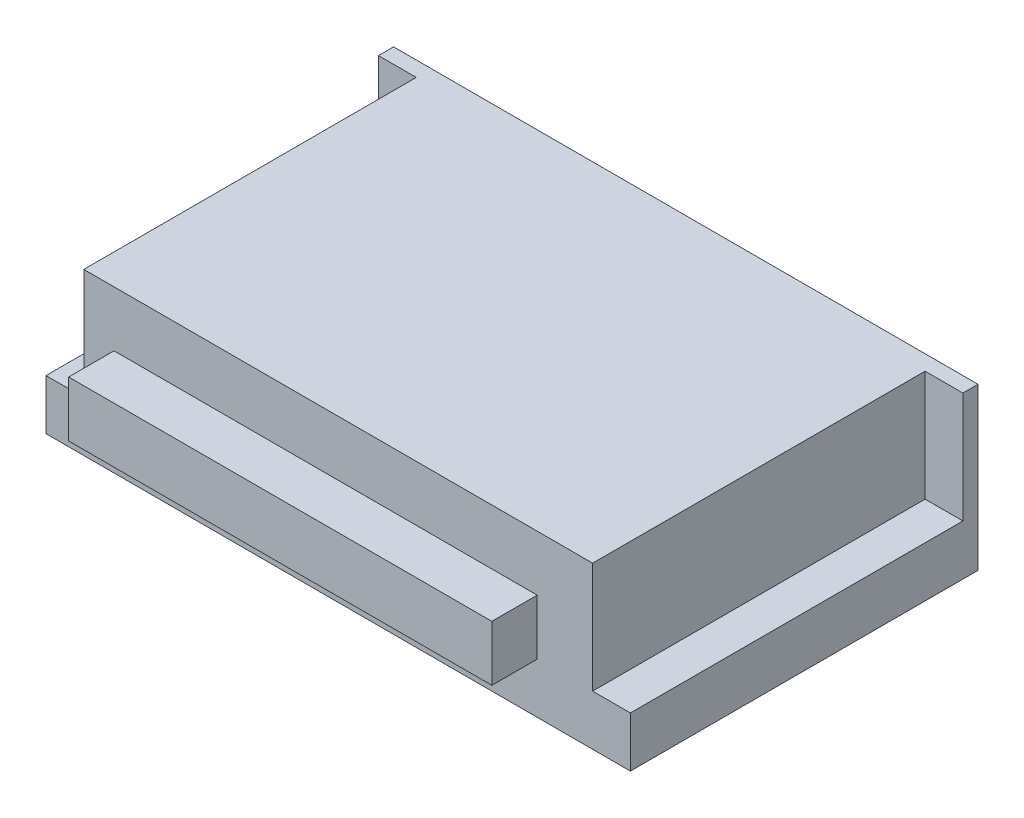
from build123d import *

# Parameters (mm, degrees)
SKETCH_1_W          = 116
SKETCH_1_H          = 69
EXTRUDE_1_DEPTH     = 32
SKETCH_2_W          = 7.5
SKETCH_2_H          = 66
CUT_EXTRUDE_1_DEPTH = 22
SKETCH_3_W          = 84
SKETCH_3_H          = 11
EXTRUDE_2_DEPTH     = 9


with BuildPart() as part:
    # 草图1 → 凸台-拉伸1 (new body)
    with BuildSketch(Plane(origin=(0, 0, 0), x_dir=(1, 0, 0), z_dir=(0, 1, 0))):
        with Locations((58, 34.5)):
            Rectangle(SKETCH_1_W, SKETCH_1_H)
    extrude(amount=EXTRUDE_1_DEPTH)

    # 草图2 → 切除-拉伸1 (cut)
    with BuildSketch(Plane(origin=(0, 32, 0), x_dir=(1, 0, 0), z_dir=(0, 1, 0))):
        with Locations((112.25, 33)):
            Rectangle(SKETCH_2_W, SKETCH_2_H)
        with Locations((3.75, 33)):
            Rectangle(SKETCH_2_W, SKETCH_2_H)
    extrude(amount=-CUT_EXTRUDE_1_DEPTH, mode=Mode.SUBTRACT)

    # 草图3 → 凸台-拉伸2 (add)
    with BuildSketch(Plane.XY):
        with Locations((55.5, 15.5)):
            Rectangle(SKETCH_3_W, SKETCH_3_H)
    extrude(amount=EXTRUDE_2_DEPTH)


solid = part.part
